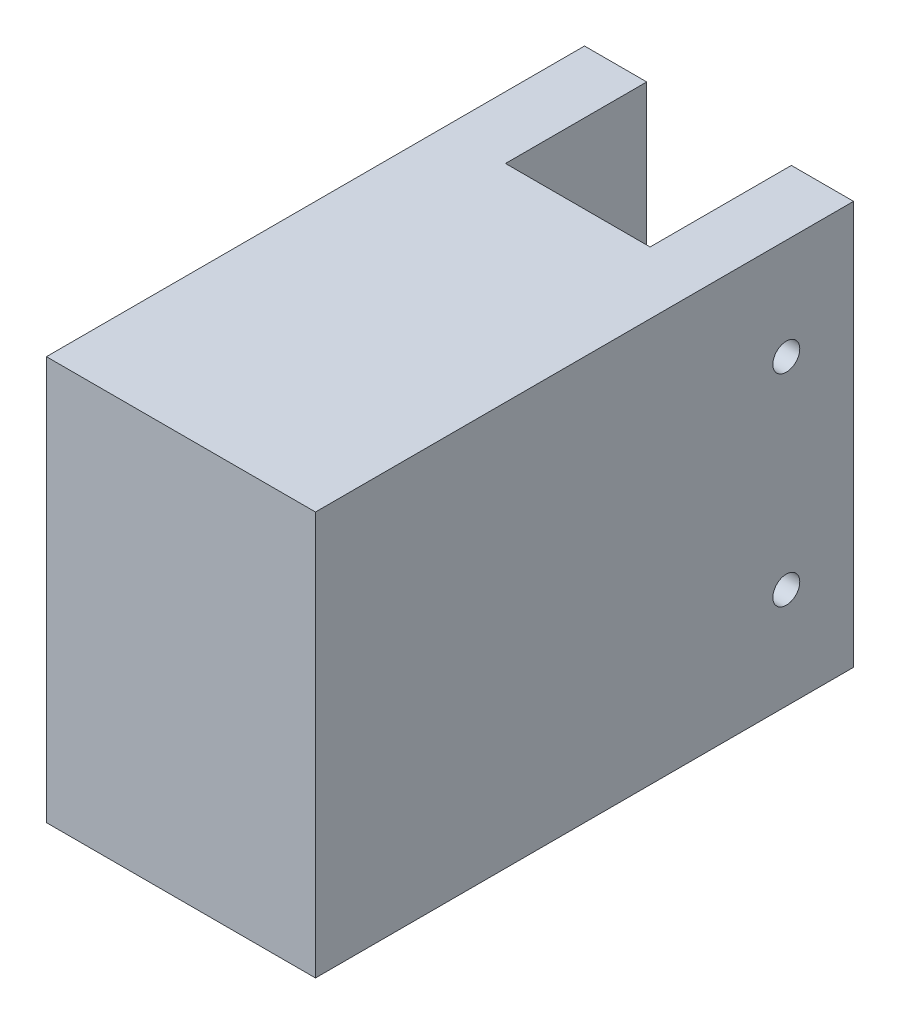
from build123d import *

# Parameters (mm, degrees)
SKETCH1_W           = 60
SKETCH1_H           = 60
SKETCH1_R           = 17.5
BOSS_EXTRUDE1_DEPTH = 40
SKETCH4_W           = 10
SKETCH4_H           = 60
BOSS_EXTRUDE2_DEPTH = 20
SKETCH5_R           = 2
CUT_EXTRUDE1_DEPTH  = 71.710678119
BOSS_EXTRUDE3_START = -15
SKETCH6_R           = 17.5
BOSS_EXTRUDE3_DEPTH = 15
SKETCH7_W           = 21.5
SKETCH7_H           = 21
CUT_EXTRUDE2_DEPTH  = 88.749643874


with BuildPart() as part:
    # Sketch1 → Boss-Extrude1 (new body)
    with BuildSketch(Plane(origin=(0, 0, 0), x_dir=(0, 0, -1), z_dir=(1, 0, 0))):
        Rectangle(SKETCH1_W, SKETCH1_H)
        Circle(SKETCH1_R, mode=Mode.SUBTRACT)
    extrude(amount=BOSS_EXTRUDE1_DEPTH)

    # Sketch4 → Boss-Extrude2 (add)
    with BuildSketch(Plane(origin=(0, 0, -30), x_dir=(-1, 0, 0), z_dir=(0, 0, -1))):
        with Locations((-35, 0)):
            Rectangle(SKETCH4_W, SKETCH4_H)
    boss_extrude2 = extrude(amount=BOSS_EXTRUDE2_DEPTH)

    # Sketch5 → Cut-Extrude1 (cut, through all)
    with BuildSketch(Plane(origin=(40, 0, 0), x_dir=(0, 0, -1), z_dir=(1, 0, 0))):
        with Locations((40, -15)):
            Circle(SKETCH5_R)
        with Locations(Location((40, 15, 0), (0, 0, 90))):
            Circle(SKETCH5_R)
    cut_extrude1 = extrude(amount=-CUT_EXTRUDE1_DEPTH, mode=Mode.SUBTRACT)

    # Mirror1: Boss-Extrude2, Cut-Extrude1 across plane
    add(boss_extrude2.mirror(Plane(origin=(20, 0, 0), x_dir=(0, 0, 1), z_dir=(1, 0, 0))))
    add(cut_extrude1.mirror(Plane(origin=(20, 0, 0), x_dir=(0, 0, 1), z_dir=(1, 0, 0))), mode=Mode.SUBTRACT)

    # Sketch6 → Boss-Extrude3 (add)
    with BuildSketch(Plane(origin=(40, 0, 0), x_dir=(0, 0, -1), z_dir=(1, 0, 0)).offset(BOSS_EXTRUDE3_START)):
        Circle(SKETCH6_R)
    extrude(amount=BOSS_EXTRUDE3_DEPTH)

    # Sketch7 → Cut-Extrude2 (cut, through all)
    with BuildSketch(Plane(origin=(0, 30, 0), x_dir=(1, 0, 0), z_dir=(0, 1, 0))):
        with Locations((20, 39.5)):
            Rectangle(SKETCH7_W, SKETCH7_H)
    extrude(amount=-CUT_EXTRUDE2_DEPTH, mode=Mode.SUBTRACT)


solid = part.part
